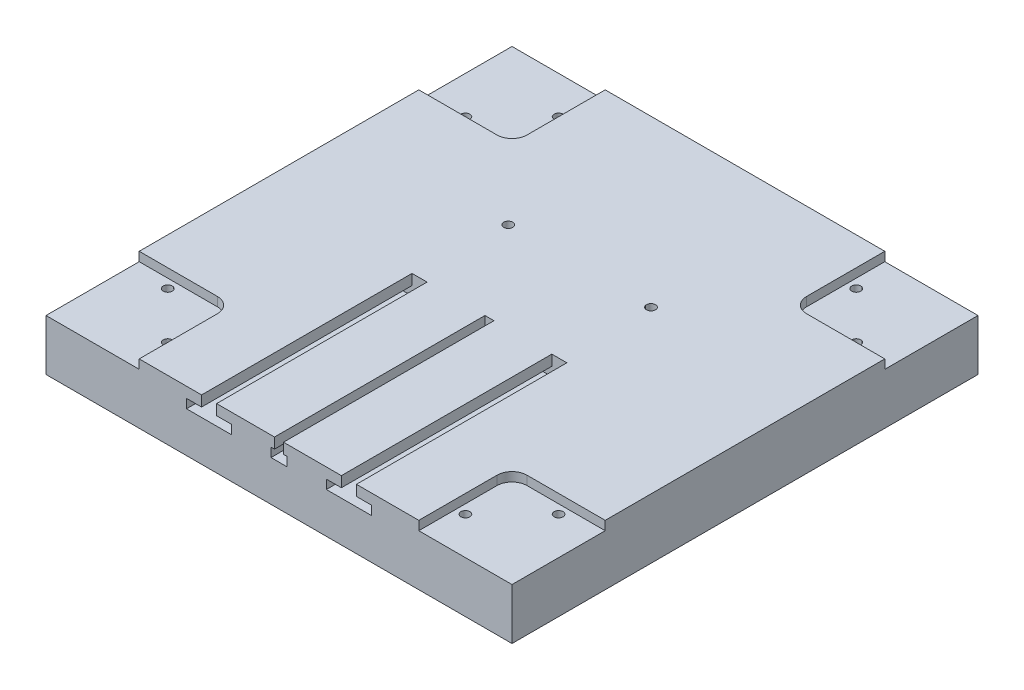
from build123d import *

# Parameters (mm, degrees)
SKETCH1_W           = 155
SKETCH1_H           = 155
BOSS_EXTRUDE2_DEPTH = 20
CUT_EXTRUDE6_DEPTH  = 3
CUT_EXTRUDE7_REACH  = 112.912
SKETCH8_R           = 1.5
CUT_EXTRUDE8_DEPTH  = 70
CUT_EXTRUDE9_REACH  = 113.411
SKETCH10_R          = 1.5


with BuildPart() as part:
    # Sketch1 → Boss-Extrude2 (new body)
    with BuildSketch(Plane(origin=(0, 0, 0), x_dir=(1, 0, 0), z_dir=(0, 1, 0))):
        Rectangle(SKETCH1_W, SKETCH1_H)
    extrude(amount=BOSS_EXTRUDE2_DEPTH)

    # Sketch7 → Cut-Extrude6 (cut)
    with BuildSketch(Plane(origin=(0, 20, 0), x_dir=(1, 0, 0), z_dir=(0, 1, 0))):
        with BuildLine():
            Line((-77.5, 77.5), (-46.5, 77.5))
            Line((-46.5, 77.5), (-46.5, 51.5))
            ThreePointArc((-46.5, 51.5), (-47.964466094, 47.964466094), (-51.5, 46.5))
            Line((-51.5, 46.5), (-77.5, 46.5))
            Line((-77.5, 46.5), (-77.5, 77.5))
        make_face()
        with BuildLine():
            Line((77.5, 46.5), (51.5, 46.5))
            ThreePointArc((51.5, 46.5), (47.964466094, 47.964466094), (46.5, 51.5))
            Line((46.5, 51.5), (46.5, 77.5))
            Line((46.5, 77.5), (77.5, 77.5))
            Line((77.5, 77.5), (77.5, 46.5))
        make_face()
        with BuildLine():
            Line((77.5, -77.5), (77.5, -46.5))
            Line((77.5, -46.5), (51.5, -46.5))
            ThreePointArc((51.5, -46.5), (47.964466094, -47.964466094), (46.5, -51.5))
            Line((46.5, -51.5), (46.5, -77.5))
            Line((46.5, -77.5), (77.5, -77.5))
        make_face()
        with BuildLine():
            Line((-46.5, -77.5), (-46.5, -51.5))
            ThreePointArc((-46.5, -51.5), (-47.964466094, -47.964466094), (-51.5, -46.5))
            Line((-51.5, -46.5), (-77.5, -46.5))
            Line((-77.5, -46.5), (-77.5, -77.5))
            Line((-77.5, -77.5), (-46.5, -77.5))
        make_face()
    extrude(amount=-CUT_EXTRUDE6_DEPTH, mode=Mode.SUBTRACT)

    # Sketch8 → Cut-Extrude7 (cut, up to next)
    with BuildSketch(Plane(origin=(0, 17, 0), x_dir=(1, 0, 0), z_dir=(0, 1, 0)), mode=Mode.PRIVATE) as cut_extrude7_sk1:
        with Locations(Location((-65, -49.5, 0), (0, 0, 270))):
            Circle(SKETCH8_R)
    cut_extrude7_tool1 = extrude(cut_extrude7_sk1.sketch, amount=-CUT_EXTRUDE7_REACH, mode=Mode.PRIVATE) & part.part
    # Sketch8 → Cut-Extrude7 (cut, up to next)
    with BuildSketch(Plane(origin=(0, 17, 0), x_dir=(1, 0, 0), z_dir=(0, 1, 0)), mode=Mode.PRIVATE) as cut_extrude7_sk2:
        with Locations(Location((-49.5, -65, 0), (0, 0, 270))):
            Circle(SKETCH8_R)
    cut_extrude7_tool2 = extrude(cut_extrude7_sk2.sketch, amount=-CUT_EXTRUDE7_REACH, mode=Mode.PRIVATE) & part.part
    # Sketch8 → Cut-Extrude7 (cut, up to next)
    with BuildSketch(Plane(origin=(0, 17, 0), x_dir=(1, 0, 0), z_dir=(0, 1, 0)), mode=Mode.PRIVATE) as cut_extrude7_sk3:
        with Locations(Location((49.5, -65, 0), (0, 0, 270))):
            Circle(SKETCH8_R)
    cut_extrude7_tool3 = extrude(cut_extrude7_sk3.sketch, amount=-CUT_EXTRUDE7_REACH, mode=Mode.PRIVATE) & part.part
    # Sketch8 → Cut-Extrude7 (cut, up to next)
    with BuildSketch(Plane(origin=(0, 17, 0), x_dir=(1, 0, 0), z_dir=(0, 1, 0)), mode=Mode.PRIVATE) as cut_extrude7_sk4:
        with Locations(Location((65, -49.5, 0), (0, 0, 270))):
            Circle(SKETCH8_R)
    cut_extrude7_tool4 = extrude(cut_extrude7_sk4.sketch, amount=-CUT_EXTRUDE7_REACH, mode=Mode.PRIVATE) & part.part
    # Sketch8 → Cut-Extrude7 (cut, up to next)
    with BuildSketch(Plane(origin=(0, 17, 0), x_dir=(1, 0, 0), z_dir=(0, 1, 0)), mode=Mode.PRIVATE) as cut_extrude7_sk5:
        with Locations(Location((49.5, 65, 0), (0, 0, 270))):
            Circle(SKETCH8_R)
    cut_extrude7_tool5 = extrude(cut_extrude7_sk5.sketch, amount=-CUT_EXTRUDE7_REACH, mode=Mode.PRIVATE) & part.part
    # Sketch8 → Cut-Extrude7 (cut, up to next)
    with BuildSketch(Plane(origin=(0, 17, 0), x_dir=(1, 0, 0), z_dir=(0, 1, 0)), mode=Mode.PRIVATE) as cut_extrude7_sk6:
        with Locations(Location((65, 49.5, 0), (0, 0, 270))):
            Circle(SKETCH8_R)
    cut_extrude7_tool6 = extrude(cut_extrude7_sk6.sketch, amount=-CUT_EXTRUDE7_REACH, mode=Mode.PRIVATE) & part.part
    # Sketch8 → Cut-Extrude7 (cut, up to next)
    with BuildSketch(Plane(origin=(0, 17, 0), x_dir=(1, 0, 0), z_dir=(0, 1, 0)), mode=Mode.PRIVATE) as cut_extrude7_sk7:
        with Locations(Location((-49.5, 65, 0), (0, 0, 270))):
            Circle(SKETCH8_R)
    cut_extrude7_tool7 = extrude(cut_extrude7_sk7.sketch, amount=-CUT_EXTRUDE7_REACH, mode=Mode.PRIVATE) & part.part
    # Sketch8 → Cut-Extrude7 (cut, up to next)
    with BuildSketch(Plane(origin=(0, 17, 0), x_dir=(1, 0, 0), z_dir=(0, 1, 0)), mode=Mode.PRIVATE) as cut_extrude7_sk8:
        with Locations(Location((-65, 49.5, 0), (0, 0, 270))):
            Circle(SKETCH8_R)
    cut_extrude7_tool8 = extrude(cut_extrude7_sk8.sketch, amount=-CUT_EXTRUDE7_REACH, mode=Mode.PRIVATE) & part.part
    add(cut_extrude7_tool1.solids().sort_by_distance((-65, 17, 49.5))[0], mode=Mode.SUBTRACT)
    add(cut_extrude7_tool2.solids().sort_by_distance((-49.5, 17, 65))[0], mode=Mode.SUBTRACT)
    add(cut_extrude7_tool3.solids().sort_by_distance((49.5, 17, 65))[0], mode=Mode.SUBTRACT)
    add(cut_extrude7_tool4.solids().sort_by_distance((65, 17, 49.5))[0], mode=Mode.SUBTRACT)
    add(cut_extrude7_tool5.solids().sort_by_distance((49.5, 17, -65))[0], mode=Mode.SUBTRACT)
    add(cut_extrude7_tool6.solids().sort_by_distance((65, 17, -49.5))[0], mode=Mode.SUBTRACT)
    add(cut_extrude7_tool7.solids().sort_by_distance((-49.5, 17, -65))[0], mode=Mode.SUBTRACT)
    add(cut_extrude7_tool8.solids().sort_by_distance((-65, 17, -49.5))[0], mode=Mode.SUBTRACT)

    # Sketch9 → Cut-Extrude8 (cut)
    with BuildSketch(Plane.XY.offset(77.5)):
        Polygon((-20.75, 20), (-25.75, 20), (-25.75, 16.5), (-30.75, 16.5), (-30.75, 13.5), (-15.75, 13.5), (-15.75, 16.5), (-20.75, 16.5), align=None)
        Polygon((25.75, 16.5), (25.75, 20), (20.75, 20), (20.75, 16.5), (15.75, 16.5), (15.75, 13.5), (30.75, 13.5), (30.75, 16.5), align=None)
        Polygon((-2.65, 16.5), (-1.5, 16.5), (-1.5, 20), (1.5, 20), (1.5, 16.5), (2.65, 16.5), (2.65, 13.5), (-2.65, 13.5), align=None)
    extrude(amount=-CUT_EXTRUDE8_DEPTH, mode=Mode.SUBTRACT)

    # Sketch10 → Cut-Extrude9 (cut, up to next)
    with BuildSketch(Plane(origin=(0, 20, 0), x_dir=(1, 0, 0), z_dir=(0, 1, 0)), mode=Mode.PRIVATE) as cut_extrude9_sk1:
        with Locations(Location((-23.75, 22.5, 0), (0, 0, 270))):
            Circle(SKETCH10_R)
    cut_extrude9_tool1 = extrude(cut_extrude9_sk1.sketch, amount=-CUT_EXTRUDE9_REACH, mode=Mode.PRIVATE) & part.part
    # Sketch10 → Cut-Extrude9 (cut, up to next)
    with BuildSketch(Plane(origin=(0, 20, 0), x_dir=(1, 0, 0), z_dir=(0, 1, 0)), mode=Mode.PRIVATE) as cut_extrude9_sk2:
        with Locations(Location((23.75, 22.5, 0), (0, 0, 270))):
            Circle(SKETCH10_R)
    cut_extrude9_tool2 = extrude(cut_extrude9_sk2.sketch, amount=-CUT_EXTRUDE9_REACH, mode=Mode.PRIVATE) & part.part
    add(cut_extrude9_tool1.solids().sort_by_distance((-23.75, 20, -22.5))[0], mode=Mode.SUBTRACT)
    add(cut_extrude9_tool2.solids().sort_by_distance((23.75, 20, -22.5))[0], mode=Mode.SUBTRACT)


solid = part.part
